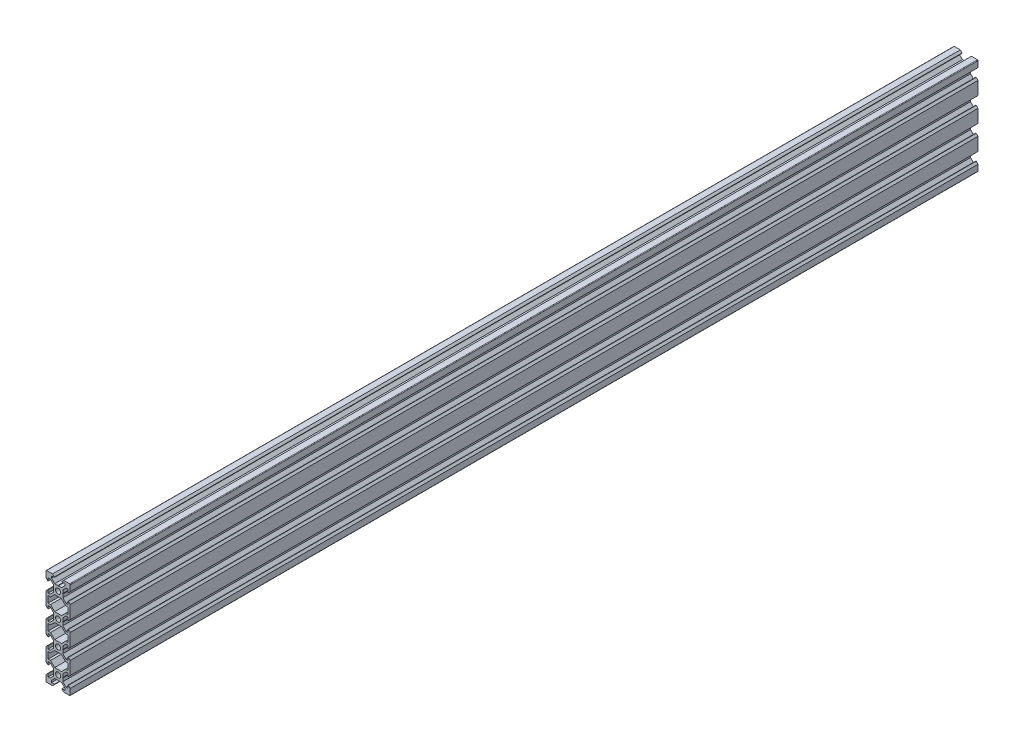
from build123d import *

# Parameters (mm, degrees)
SKETCH1_R           = 2.1
BOSS_EXTRUDE1_DEPTH = 750


with BuildPart() as part:
    # Sketch1 → Boss-Extrude1 (new body)
    with BuildSketch(Plane.XY):
        with BuildLine():
            Line((4.58, -40), (9.5, -40))
            ThreePointArc((9.5, -40), (9.853553391, -39.853553391), (10, -39.5))
            Line((10, -39.5), (10, -34.58))
            Line((10, -34.58), (8.545, -33.125))
            Line((8.545, -33.125), (8.2, -33.125))
            Line((8.2, -33.125), (8.2, -35.5))
            Line((8.2, -35.5), (6.560660172, -35.5))
            Line((6.560660172, -35.5), (3.9, -32.839339828))
            Line((3.9, -32.839339828), (3.9, -30.21))
            Line((3.9, -30.21), (3.69, -30))
            Line((3.69, -30), (3.9, -29.79))
            Line((3.9, -29.79), (3.9, -27.160660172))
            Line((3.9, -27.160660172), (6.560660172, -24.5))
            Line((6.560660172, -24.5), (8.2, -24.5))
            Line((8.2, -24.5), (8.2, -26.875))
            Line((8.2, -26.875), (8.545, -26.875))
            Line((8.545, -26.875), (10, -25.42))
            Line((10, -25.42), (10, -14.58))
            Line((10, -14.58), (8.545, -13.125))
            Line((8.545, -13.125), (8.2, -13.125))
            Line((8.2, -13.125), (8.2, -15.5))
            Line((8.2, -15.5), (6.560660172, -15.5))
            Line((6.560660172, -15.5), (3.9, -12.839339828))
            Line((3.9, -12.839339828), (3.9, -10.21))
            Line((3.9, -10.21), (3.69, -10))
            Line((3.69, -10), (3.9, -9.79))
            Line((3.9, -9.79), (3.9, -7.160660172))
            Line((3.9, -7.160660172), (6.560660172, -4.5))
            Line((6.560660172, -4.5), (8.2, -4.5))
            Line((8.2, -4.5), (8.2, -6.875))
            Line((8.2, -6.875), (8.545, -6.875))
            Line((8.545, -6.875), (10, -5.42))
            Line((10, -5.42), (10, 5.42))
            Line((10, 5.42), (8.545, 6.875))
            Line((8.545, 6.875), (8.2, 6.875))
            Line((8.2, 6.875), (8.2, 4.5))
            Line((8.2, 4.5), (6.560660172, 4.5))
            Line((6.560660172, 4.5), (3.9, 7.160660172))
            Line((3.9, 7.160660172), (3.9, 9.79))
            Line((3.9, 9.79), (3.69, 10))
            Line((3.69, 10), (3.9, 10.21))
            Line((3.9, 10.21), (3.9, 12.839339828))
            Line((3.9, 12.839339828), (6.560660172, 15.5))
            Line((6.560660172, 15.5), (8.2, 15.5))
            Line((8.2, 15.5), (8.2, 13.125))
            Line((8.2, 13.125), (8.545, 13.125))
            Line((8.545, 13.125), (10, 14.58))
            Line((10, 14.58), (10, 25.42))
            Line((10, 25.42), (8.545, 26.875))
            Line((8.545, 26.875), (8.2, 26.875))
            Line((8.2, 26.875), (8.2, 24.5))
            Line((8.2, 24.5), (6.560660172, 24.5))
            Line((6.560660172, 24.5), (3.9, 27.160660172))
            Line((3.9, 27.160660172), (3.9, 29.79))
            Line((3.9, 29.79), (3.69, 30))
            Line((3.69, 30), (3.9, 30.21))
            Line((3.9, 30.21), (3.9, 32.839339828))
            Line((3.9, 32.839339828), (6.560660172, 35.5))
            Line((6.560660172, 35.5), (8.2, 35.5))
            Line((8.2, 35.5), (8.2, 33.125))
            Line((8.2, 33.125), (8.545, 33.125))
            Line((8.545, 33.125), (10, 34.58))
            Line((10, 34.58), (10, 39.5))
            ThreePointArc((10, 39.5), (9.853553391, 39.853553391), (9.5, 40))
            Line((9.5, 40), (4.58, 40))
            Line((4.58, 40), (3.125, 38.545))
            Line((3.125, 38.545), (3.125, 38.2))
            Line((3.125, 38.2), (5.5, 38.2))
            Line((5.5, 38.2), (5.5, 36.560660172))
            Line((5.5, 36.560660172), (2.839339828, 33.9))
            Line((2.839339828, 33.9), (0.21, 33.9))
            Line((0.21, 33.9), (0, 33.69))
            Line((0, 33.69), (-0.21, 33.9))
            Line((-0.21, 33.9), (-2.839339828, 33.9))
            Line((-2.839339828, 33.9), (-5.5, 36.560660172))
            Line((-5.5, 36.560660172), (-5.5, 38.2))
            Line((-5.5, 38.2), (-3.125, 38.2))
            Line((-3.125, 38.2), (-3.125, 38.545))
            Line((-3.125, 38.545), (-4.58, 40))
            Line((-4.58, 40), (-9.5, 40))
            ThreePointArc((-9.5, 40), (-9.853553391, 39.853553391), (-10, 39.5))
            Line((-10, 39.5), (-10, 34.58))
            Line((-10, 34.58), (-8.545, 33.125))
            Line((-8.545, 33.125), (-8.2, 33.125))
            Line((-8.2, 33.125), (-8.2, 35.5))
            Line((-8.2, 35.5), (-6.560660172, 35.5))
            Line((-6.560660172, 35.5), (-3.9, 32.839339828))
            Line((-3.9, 32.839339828), (-3.9, 30.21))
            Line((-3.9, 30.21), (-3.69, 30))
            Line((-3.69, 30), (-3.9, 29.79))
            Line((-3.9, 29.79), (-3.9, 27.160660172))
            Line((-3.9, 27.160660172), (-6.560660172, 24.5))
            Line((-6.560660172, 24.5), (-8.2, 24.5))
            Line((-8.2, 24.5), (-8.2, 26.875))
            Line((-8.2, 26.875), (-8.545, 26.875))
            Line((-8.545, 26.875), (-10, 25.42))
            Line((-10, 25.42), (-10, 14.58))
            Line((-10, 14.58), (-8.545, 13.125))
            Line((-8.545, 13.125), (-8.2, 13.125))
            Line((-8.2, 13.125), (-8.2, 15.5))
            Line((-8.2, 15.5), (-6.560660172, 15.5))
            Line((-6.560660172, 15.5), (-3.9, 12.839339828))
            Line((-3.9, 12.839339828), (-3.9, 10.21))
            Line((-3.9, 10.21), (-3.69, 10))
            Line((-3.69, 10), (-3.9, 9.79))
            Line((-3.9, 9.79), (-3.9, 7.160660172))
            Line((-3.9, 7.160660172), (-6.560660172, 4.5))
            Line((-6.560660172, 4.5), (-8.2, 4.5))
            Line((-8.2, 4.5), (-8.2, 6.875))
            Line((-8.2, 6.875), (-8.545, 6.875))
            Line((-8.545, 6.875), (-10, 5.42))
            Line((-10, 5.42), (-10, -5.42))
            Line((-10, -5.42), (-8.545, -6.875))
            Line((-8.545, -6.875), (-8.2, -6.875))
            Line((-8.2, -6.875), (-8.2, -4.5))
            Line((-8.2, -4.5), (-6.560660172, -4.5))
            Line((-6.560660172, -4.5), (-3.9, -7.160660172))
            Line((-3.9, -7.160660172), (-3.9, -9.79))
            Line((-3.9, -9.79), (-3.69, -10))
            Line((-3.69, -10), (-3.9, -10.21))
            Line((-3.9, -10.21), (-3.9, -12.839339828))
            Line((-3.9, -12.839339828), (-6.560660172, -15.5))
            Line((-6.560660172, -15.5), (-8.2, -15.5))
            Line((-8.2, -15.5), (-8.2, -13.125))
            Line((-8.2, -13.125), (-8.545, -13.125))
            Line((-8.545, -13.125), (-10, -14.58))
            Line((-10, -14.58), (-10, -25.42))
            Line((-10, -25.42), (-8.545, -26.875))
            Line((-8.545, -26.875), (-8.2, -26.875))
            Line((-8.2, -26.875), (-8.2, -24.5))
            Line((-8.2, -24.5), (-6.560660172, -24.5))
            Line((-6.560660172, -24.5), (-3.9, -27.160660172))
            Line((-3.9, -27.160660172), (-3.9, -29.79))
            Line((-3.9, -29.79), (-3.69, -30))
            Line((-3.69, -30), (-3.9, -30.21))
            Line((-3.9, -30.21), (-3.9, -32.839339828))
            Line((-3.9, -32.839339828), (-6.560660172, -35.5))
            Line((-6.560660172, -35.5), (-8.2, -35.5))
            Line((-8.2, -35.5), (-8.2, -33.125))
            Line((-8.2, -33.125), (-8.545, -33.125))
            Line((-8.545, -33.125), (-10, -34.58))
            Line((-10, -34.58), (-10, -39.5))
            ThreePointArc((-10, -39.5), (-9.853553391, -39.853553391), (-9.5, -40))
            Line((-9.5, -40), (-4.58, -40))
            Line((-4.58, -40), (-3.125, -38.545))
            Line((-3.125, -38.545), (-3.125, -38.2))
            Line((-3.125, -38.2), (-5.5, -38.2))
            Line((-5.5, -38.2), (-5.5, -36.560660172))
            Line((-5.5, -36.560660172), (-2.839339828, -33.9))
            Line((-2.839339828, -33.9), (-0.21, -33.9))
            Line((-0.21, -33.9), (0, -33.69))
            Line((0, -33.69), (0.21, -33.9))
            Line((0.21, -33.9), (2.839339828, -33.9))
            Line((2.839339828, -33.9), (5.5, -36.560660172))
            Line((5.5, -36.560660172), (5.5, -38.2))
            Line((5.5, -38.2), (3.125, -38.2))
            Line((3.125, -38.2), (3.125, -38.545))
            Line((3.125, -38.545), (4.58, -40))
        make_face()
        with Locations((0, -30)):
            Circle(SKETCH1_R, mode=Mode.SUBTRACT)
        Polygon((-6.239339828, -22.7), (-8.2, -22.7), (-8.2, -17.3), (-6.239339828, -17.3), (-2.839339828, -13.9), (2.839339828, -13.9), (6.239339828, -17.3), (8.2, -17.3), (8.2, -22.7), (6.239339828, -22.7), (2.839339828, -26.1), (-2.839339828, -26.1), align=None, mode=Mode.SUBTRACT)
        with Locations((0, -10)):
            Circle(SKETCH1_R, mode=Mode.SUBTRACT)
        Polygon((-6.239339828, -2.7), (-8.2, -2.7), (-8.2, 2.7), (-6.239339828, 2.7), (-2.839339828, 6.1), (2.839339828, 6.1), (6.239339828, 2.7), (8.2, 2.7), (8.2, -2.7), (6.239339828, -2.7), (2.839339828, -6.1), (-2.839339828, -6.1), align=None, mode=Mode.SUBTRACT)
        with Locations((0, 10)):
            Circle(SKETCH1_R, mode=Mode.SUBTRACT)
        Polygon((-6.239339828, 17.3), (-8.2, 17.3), (-8.2, 22.7), (-6.239339828, 22.7), (-2.839339828, 26.1), (2.839339828, 26.1), (6.239339828, 22.7), (8.2, 22.7), (8.2, 17.3), (6.239339828, 17.3), (2.839339828, 13.9), (-2.839339828, 13.9), align=None, mode=Mode.SUBTRACT)
        with Locations((0, 30)):
            Circle(SKETCH1_R, mode=Mode.SUBTRACT)
    extrude(amount=BOSS_EXTRUDE1_DEPTH)


solid = part.part
